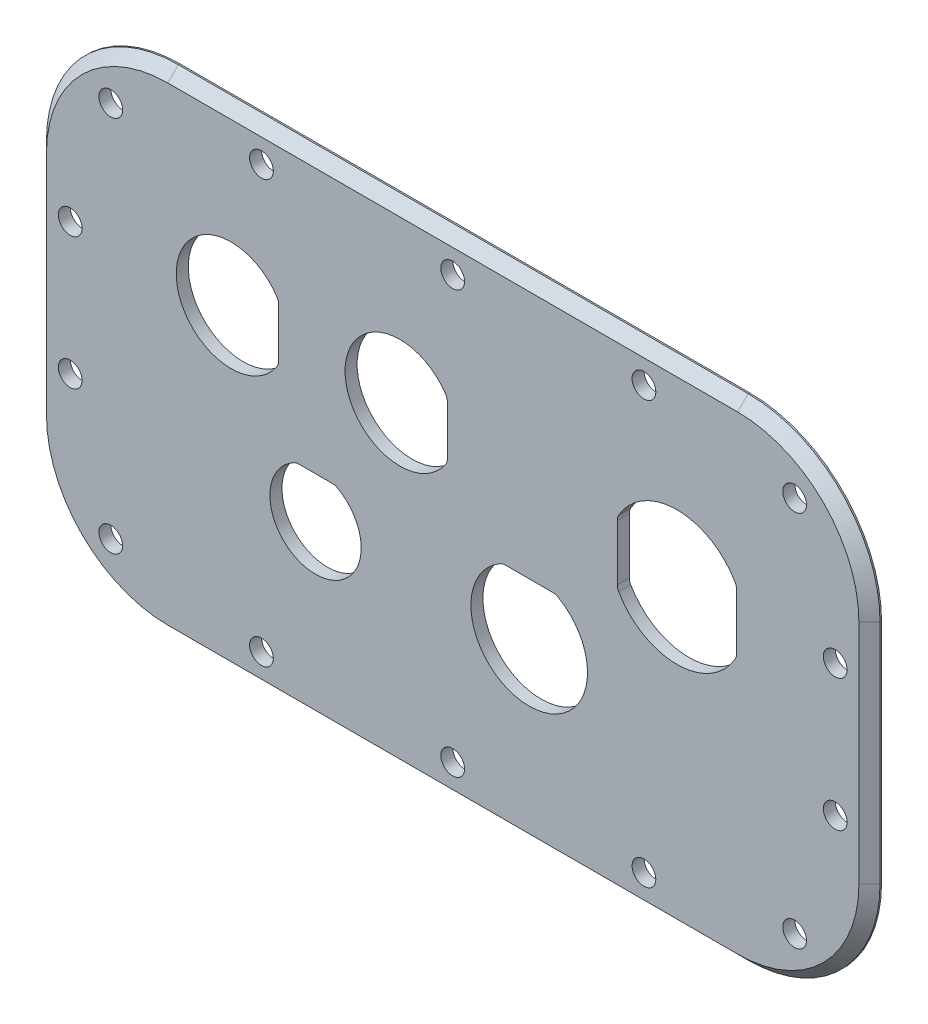
from build123d import *

# Parameters (mm, degrees)
SKETCH1_W            = 158
SKETCH1_H            = 93
BOSS_EXTRUDE1_DEPTH  = 1.143
FILLET1_R            = 25
M4_CLEARANCE_HOLE1_D = 4.5
CHAMFER2_SIZE        = 2
CUT_EXTRUDE1_REACH   = 93.698
FILLET2_R            = 2


with BuildPart() as part:
    # Sketch1 → Boss-Extrude1 (new, symmetric)
    with BuildSketch(Plane.XY):
        Rectangle(SKETCH1_W, SKETCH1_H)
    extrude(amount=BOSS_EXTRUDE1_DEPTH, both=True)

    # Fillet1
    fillet1_edges = [part.edges().sort_by_distance(p)[0] for p in [
        (-79, 46.5, 0),
        (79, 46.5, 0),
        (79, -46.5, 0),
        (-79, -46.5, 0),
    ]]
    fillet(fillet1_edges, radius=FILLET1_R)

    # M4 Clearance Hole1 (through all)
    with Locations(Plane.XY.offset(1.143)):
        with Locations((72.5, 12.5), (0, 40), (0, -40), (-36.25, -40), (-36.25, 40), (36.25, 40), (36.25, -40), (-64.814123615, 35.759516477), (-64.814123615, -35.759516477), (64.814123615, -35.759516477), (64.814123615, 35.759516477), (-72.5, 12.5), (-72.5, -12.5), (72.5, -12.5)):
            Hole(M4_CLEARANCE_HOLE1_D / 2)

    # Chamfer2
    chamfer2_edges = [part.edges().sort_by_distance(p)[0] for p in [
        (-79, 0, 1.143),
        (0, 46.5, 1.143),
        (0, -46.5, 1.143),
        (79, 0, 1.143),
        (71.67766953, 39.17766953, 1.143),
        (-71.67766953, -39.17766953, 1.143),
        (71.67766953, -39.17766953, 1.143),
        (-71.67766953, 39.17766953, 1.143),
    ]]
    chamfer(chamfer2_edges, length=CHAMFER2_SIZE)

    # Sketch7 → Cut-Extrude1 (cut, up to next)
    with BuildSketch(Plane.XY.offset(1.143), mode=Mode.PRIVATE) as cut_extrude1_sk1:
        with BuildLine():
            Line((-33, 19.211525688), (-33, 8.788474312))
            ThreePointArc((-33, 8.788474312), (-52.4, 14), (-33, 19.211525688))
        make_face()
    cut_extrude1_tool1 = extrude(cut_extrude1_sk1.sketch, amount=-CUT_EXTRUDE1_REACH, mode=Mode.PRIVATE) & part.part
    # Sketch7 → Cut-Extrude1 (cut, up to next)
    with BuildSketch(Plane.XY.offset(1.143), mode=Mode.PRIVATE) as cut_extrude1_sk2:
        with BuildLine():
            Line((-29.633180425, -5.65), (-22.366819575, -5.65))
            ThreePointArc((-22.366819575, -5.65), (-26, -22.15), (-29.633180425, -5.65))
        make_face()
    cut_extrude1_tool2 = extrude(cut_extrude1_sk2.sketch, amount=-CUT_EXTRUDE1_REACH, mode=Mode.PRIVATE) & part.part
    # Sketch7 → Cut-Extrude1 (cut, up to next)
    with BuildSketch(Plane.XY.offset(1.143), mode=Mode.PRIVATE) as cut_extrude1_sk3:
        with BuildLine():
            Line((-1, 19.211525688), (-1, 8.788474312))
            ThreePointArc((-1, 8.788474312), (-20.4, 14), (-1, 19.211525688))
        make_face()
    cut_extrude1_tool3 = extrude(cut_extrude1_sk3.sketch, amount=-CUT_EXTRUDE1_REACH, mode=Mode.PRIVATE) & part.part
    # Sketch7 → Cut-Extrude1 (cut, up to next)
    with BuildSketch(Plane.XY.offset(1.143), mode=Mode.PRIVATE) as cut_extrude1_sk4:
        with BuildLine():
            Line((31.197, 15.790698663), (31.197, 4.209301337))
            ThreePointArc((31.197, 4.209301337), (42.5, -2.7), (53.803, 4.209301337))
            Line((53.803, 4.209301337), (53.803, 15.790698663))
            ThreePointArc((53.803, 15.790698663), (42.5, 22.7), (31.197, 15.790698663))
        make_face()
    cut_extrude1_tool4 = extrude(cut_extrude1_sk4.sketch, amount=-CUT_EXTRUDE1_REACH, mode=Mode.PRIVATE) & part.part
    # Sketch7 → Cut-Extrude1 (cut, up to next)
    with BuildSketch(Plane.XY.offset(1.143), mode=Mode.PRIVATE) as cut_extrude1_sk5:
        with BuildLine():
            Line((9.49200639, -2.65), (19.50799361, -2.65))
            ThreePointArc((19.50799361, -2.65), (14.5, -23.55), (9.49200639, -2.65))
        make_face()
    cut_extrude1_tool5 = extrude(cut_extrude1_sk5.sketch, amount=-CUT_EXTRUDE1_REACH, mode=Mode.PRIVATE) & part.part
    add(cut_extrude1_tool1.solids().sort_by_distance((-42.286012, 14, 1.143))[0], mode=Mode.SUBTRACT)
    add(cut_extrude1_tool2.solids().sort_by_distance((-26, -13.638318, 1.143))[0], mode=Mode.SUBTRACT)
    add(cut_extrude1_tool3.solids().sort_by_distance((-10.286012, 14, 1.143))[0], mode=Mode.SUBTRACT)
    add(cut_extrude1_tool4.solids().sort_by_distance((42.5, 10, 1.143))[0], mode=Mode.SUBTRACT)
    add(cut_extrude1_tool5.solids().sort_by_distance((14.5, -12.722997, 1.143))[0], mode=Mode.SUBTRACT)

    # Fillet2
    fillet2_edges = [part.edges().sort_by_distance(p)[0] for p in [
        (31.197, 15.790698663, 0),
        (53.803, 15.790698663, 0),
        (53.803, 4.209301337, 0),
        (31.197, 4.209301337, 0),
        (19.50799361, -2.65, 0),
        (9.49200639, -2.65, 0),
        (-1, 8.788474312, 0),
        (-1, 19.211525688, 0),
        (-33, 8.788474312, 0),
        (-33, 19.211525688, 0),
        (-22.366819575, -5.65, 0),
        (-29.633180425, -5.65, 0),
    ]]
    fillet(fillet2_edges, radius=FILLET2_R)


solid = part.part
